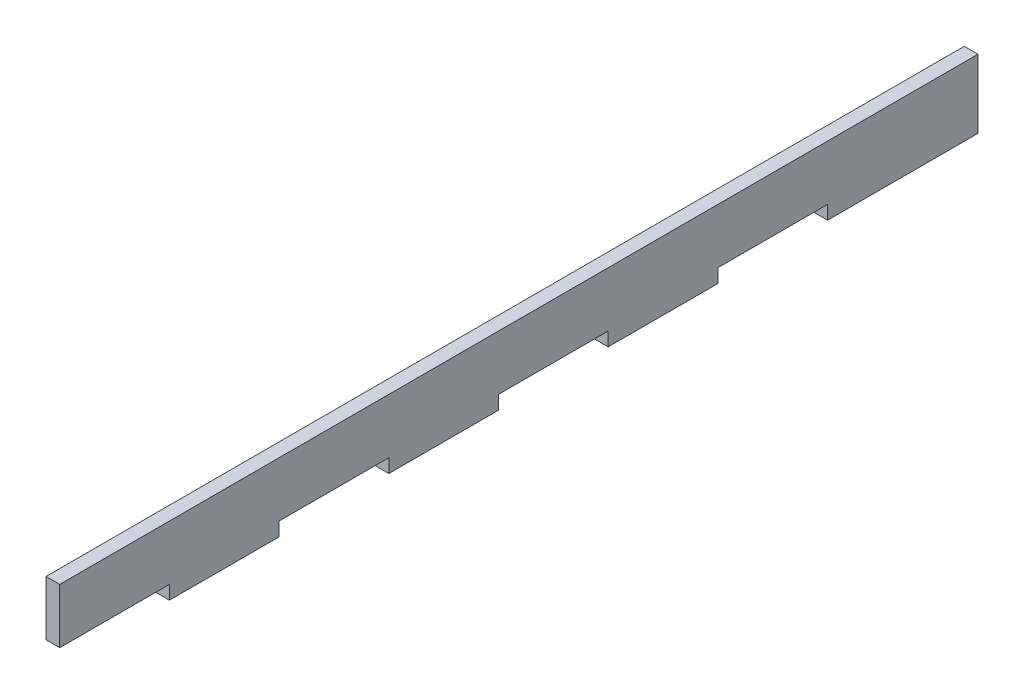
from build123d import *

# Parameters (mm, degrees)
BOSS_EXTRUDE1_DEPTH = 6.35


with BuildPart() as part:
    # Sketch2 → Boss-Extrude1 (new body)
    with BuildSketch(Plane(origin=(0, 0, 0), x_dir=(0, 0, -1), z_dir=(1, 0, 0))):
        Polygon((48.319405744, 0), (99.119405744, 0), (99.119405744, 6.35), (149.919405744, 6.35), (149.919405744, 0), (200.719405744, 0), (200.719405744, 6.35), (251.519405744, 6.35), (251.519405744, 0), (302.319405744, 0), (302.319405744, 6.35), (353.119405744, 6.35), (353.119405744, 0), (422.789544579, 0), (422.789544579, 31.75), (-2.480594256, 31.75), (-2.480594256, 6.35), (48.319405744, 6.35), align=None)
    extrude(amount=BOSS_EXTRUDE1_DEPTH)


solid = part.part
